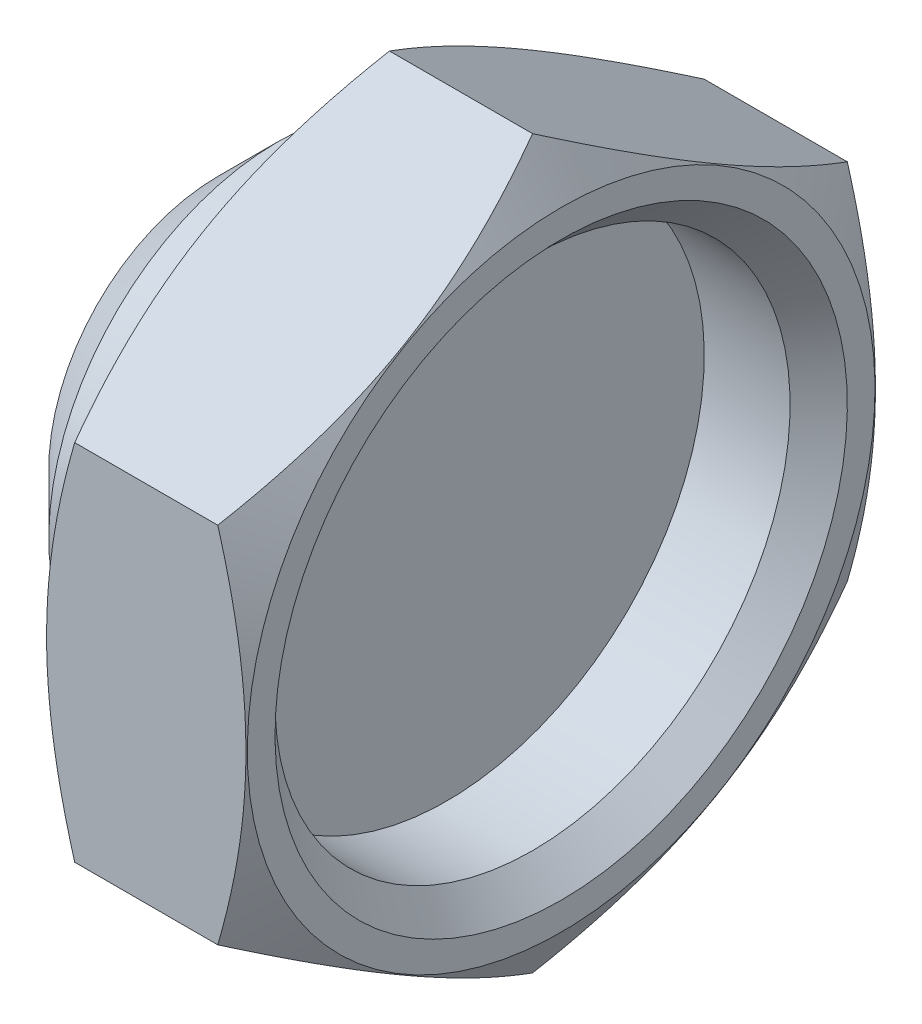
from build123d import *

# Parameters (mm, degrees)
CUT_EXTRUDE_1_DEPTH = 10
SKETCH_3_R          = 4.5
CUT_EXTRUDE_2_DEPTH = 2
CHAMFER_1_SIZE      = 0.5


with BuildPart() as part:
    # Эскиз1 → Повернуть1 (revolve)
    with BuildSketch(Plane.XY, mode=Mode.PRIVATE) as revolve_1_sk:
        Polygon((0, 0), (-6, 0), (-6, -2.952380952), (-4.952380952, -4), (-3.5, -4), (-3.5, -5.483974596), (-3, -6.35), (-0.5, -6.35), (0, -5.483974596), align=None)
    revolve(revolve_1_sk.sketch.rotate(Axis((0, 0, 0), (-1, 0, 0)), 180), axis=Axis((0, 0, 0), (-1, 0, 0)))

    # Эскиз2 → Вырез-Вытянуть1 (cut)
    with BuildSketch(Plane(origin=(0, 0, 0), x_dir=(0, 0, -1), z_dir=(1, 0, 0))):
        with BuildLine():
            Line((-5.499261314, 3.175), (0, 6.35))
            ThreePointArc((0, 6.35), (-3.175, 5.499261314), (-5.499261314, 3.175))
        make_face()
        with BuildLine():
            ThreePointArc((5.499261314, 3.175), (3.175, 5.499261314), (0, 6.35))
            Line((0, 6.35), (5.499261314, 3.175))
        make_face()
        with BuildLine():
            ThreePointArc((6.35, 0), (6.133628997, 1.643500936), (5.499261314, 3.175))
            Line((5.499261314, 3.175), (5.499261314, -3.175))
            ThreePointArc((5.499261314, -3.175), (6.133628997, -1.643500936), (6.35, 0))
        make_face()
        with BuildLine():
            ThreePointArc((0, -6.35), (3.175, -5.499261314), (5.499261314, -3.175))
            Line((5.499261314, -3.175), (0, -6.35))
        make_face()
        with BuildLine():
            Line((0, -6.35), (-5.499261314, -3.175))
            ThreePointArc((-5.499261314, -3.175), (-3.175, -5.499261314), (0, -6.35))
        make_face()
        with BuildLine():
            Line((-5.499261314, -3.175), (-5.499261314, 3.175))
            ThreePointArc((-5.499261314, 3.175), (-6.35, 0), (-5.499261314, -3.175))
        make_face()
    extrude(amount=-CUT_EXTRUDE_1_DEPTH, mode=Mode.SUBTRACT)

    # Эскиз3 → Вырез-Вытянуть2 (cut)
    with BuildSketch(Plane(origin=(0, 0, 0), x_dir=(0, 0, -1), z_dir=(1, 0, 0))):
        with Locations(Location((0, 0, 0), (0, 0, 90))):
            Circle(SKETCH_3_R)
    extrude(amount=-CUT_EXTRUDE_2_DEPTH, mode=Mode.SUBTRACT)

    # Фаска1
    chamfer_1_edges = [part.edges().sort_by_distance(p)[0] for p in [
        (0, -4.5, 0),
    ]]
    chamfer(chamfer_1_edges, length=CHAMFER_1_SIZE)


solid = part.part
